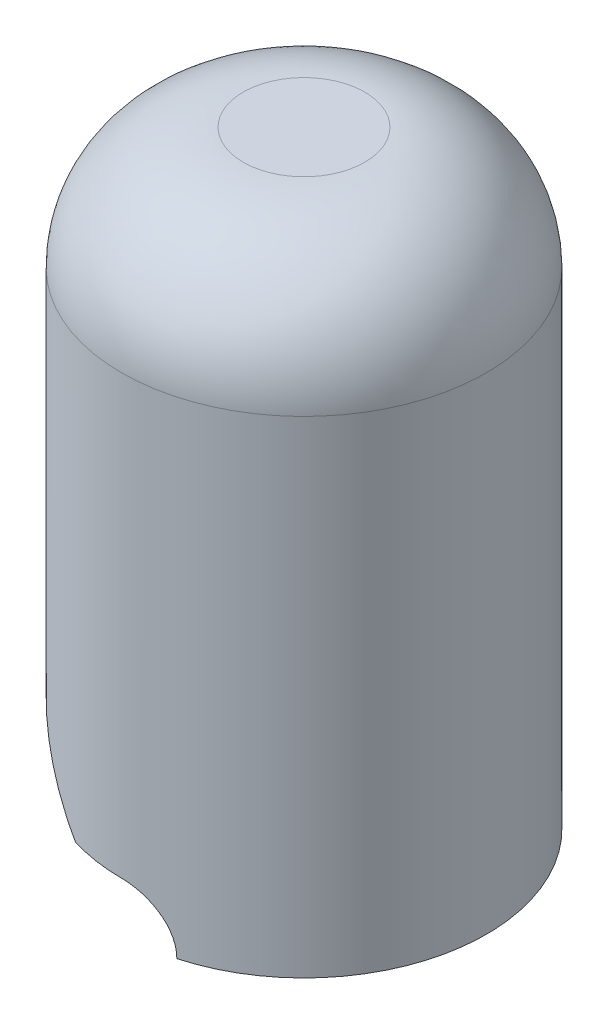
from build123d import *

# Parameters (mm, degrees)
CROQUIS1_R              = 15
SALIENTE_EXTRUIR1_DEPTH = 50
CROQUIS2_R              = 4
SALIENTE_EXTRUIR2_DEPTH = 7.5
CORTAR_EXTRUIR2_START   = 8
CROQUIS3_R              = 4
CORTAR_EXTRUIR2_DEPTH   = 8
REDONDEO1_R             = 10
CORTAR_EXTRUIR3_DEPTH   = 15
CORTAR_EXTRUIR4_DEPTH   = 15
CROQUIS6_R              = 2.5
CORTAR_EXTRUIR5_DEPTH   = 15


with BuildPart() as part:
    # Croquis1 → Saliente-Extruir1 (new body)
    with BuildSketch(Plane(origin=(0, 0, 0), x_dir=(1, 0, 0), z_dir=(0, 1, 0))):
        with Locations(Location((0, 0, 0), (0, 0, 270))):
            Circle(CROQUIS1_R)
    extrude(amount=SALIENTE_EXTRUIR1_DEPTH)

    # Croquis2 → Saliente-Extruir2 (add, symmetric)
    with BuildSketch(Plane.XY):
        Circle(CROQUIS2_R)
    extrude(amount=SALIENTE_EXTRUIR2_DEPTH, both=True)

    # Croquis3 → Cortar-Extruir2 (cut)
    with BuildSketch(Plane.XY.offset(7.5).offset(CORTAR_EXTRUIR2_START)):
        Circle(CROQUIS3_R)
    cortar_extruir2 = extrude(amount=-CORTAR_EXTRUIR2_DEPTH, mode=Mode.SUBTRACT)

    # Simetría1: Cortar-Extruir2 across plane
    add(cortar_extruir2.mirror(Plane.XY), mode=Mode.SUBTRACT)

    # Redondeo1
    redondeo1_edges = [part.edges().sort_by_distance(p)[0] for p in [
        (0, 50, -15),
    ]]
    fillet(redondeo1_edges, radius=REDONDEO1_R)

    # Croquis4 → Cortar-Extruir3 (cut, symmetric)
    with BuildSketch(Plane.XY):
        Polygon((-15, 13.376474032), (-15, 0), (-4, 0), (-4, 3.567059742), align=None)
    extrude(amount=CORTAR_EXTRUIR3_DEPTH, both=True, mode=Mode.SUBTRACT)

    # Croquis5 → Cortar-Extruir4 (cut, symmetric)
    with BuildSketch(Plane.XY):
        with BuildLine():
            Line((0, 4), (-7.90720464, 4))
            Line((-7.90720464, 4), (-7.90720464, -4))
            Line((-7.90720464, -4), (0, -4))
            ThreePointArc((0, -4), (-4, 0), (0, 4))
        make_face()
    extrude(amount=CORTAR_EXTRUIR4_DEPTH, both=True, mode=Mode.SUBTRACT)

    # Croquis6 → Cortar-Extruir5 (cut)
    with BuildSketch(Plane.XY.offset(7.5)):
        Circle(CROQUIS6_R)
    extrude(amount=-CORTAR_EXTRUIR5_DEPTH, mode=Mode.SUBTRACT)


solid = part.part
